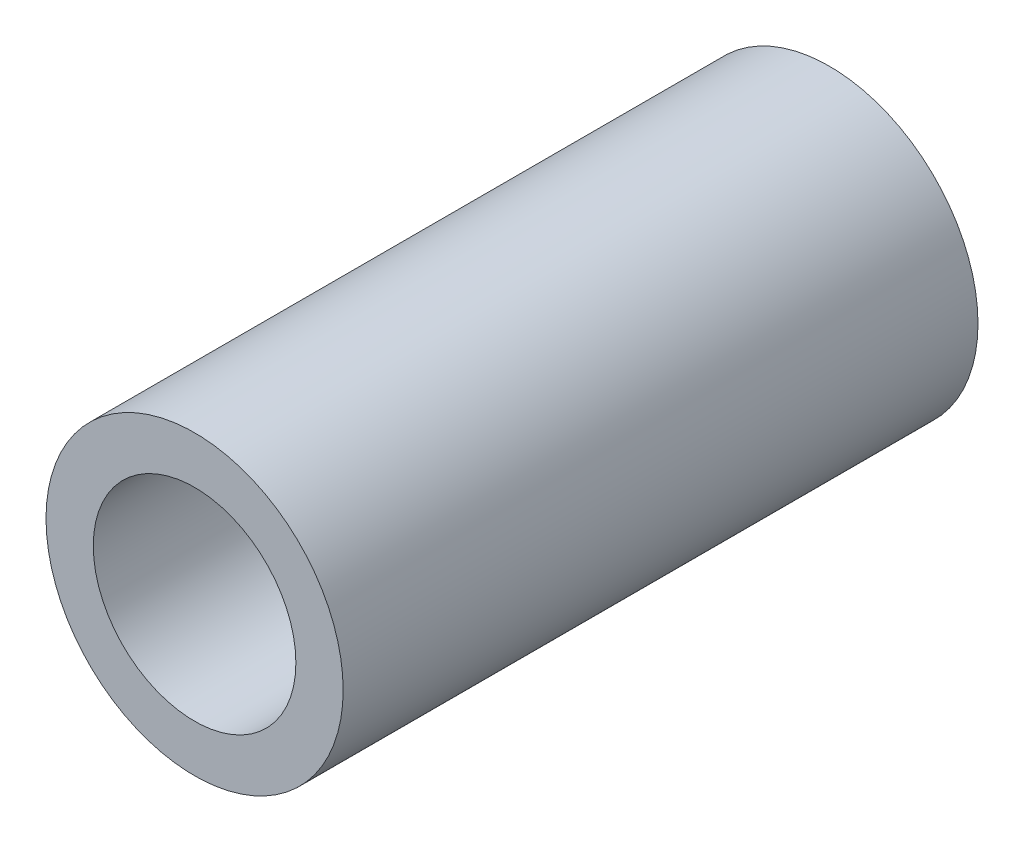
from build123d import *

# Parameters (mm, degrees)
SKETCH1_W = 47
SKETCH1_H = 3.5


with BuildPart() as part:
    # Sketch1 → Revolve1 (revolve)
    with BuildSketch(Plane(origin=(0, 0, 0), x_dir=(0, 0, -1), z_dir=(1, 0, 0)), mode=Mode.PRIVATE) as revolve1_sk:
        with Locations((-23.5, -9.25)):
            Rectangle(SKETCH1_W, SKETCH1_H)
    revolve(revolve1_sk.sketch.rotate(Axis((0, 0, 33.825503356), (0, 0, -1)), 270), axis=Axis((0, 0, 33.825503356), (0, 0, -1)))


solid = part.part
